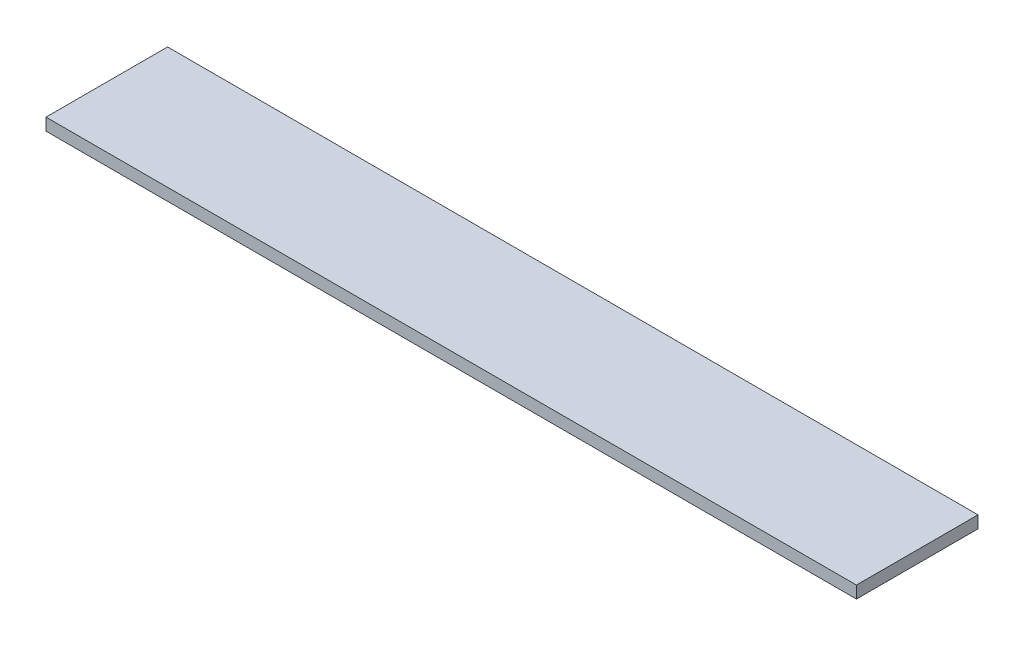
from build123d import *

# Parameters (mm, degrees)
SKETCH1_W           = 200
SKETCH1_H           = 30
BOSS_EXTRUDE1_DEPTH = 3


with BuildPart() as part:
    # Sketch1 → Boss-Extrude1 (new body)
    with BuildSketch(Plane(origin=(0, 0, 0), x_dir=(1, 0, 0), z_dir=(0, 1, 0))):
        with Locations((28.212176256, 13.452491118)):
            Rectangle(SKETCH1_W, SKETCH1_H)
    extrude(amount=BOSS_EXTRUDE1_DEPTH)


solid = part.part
